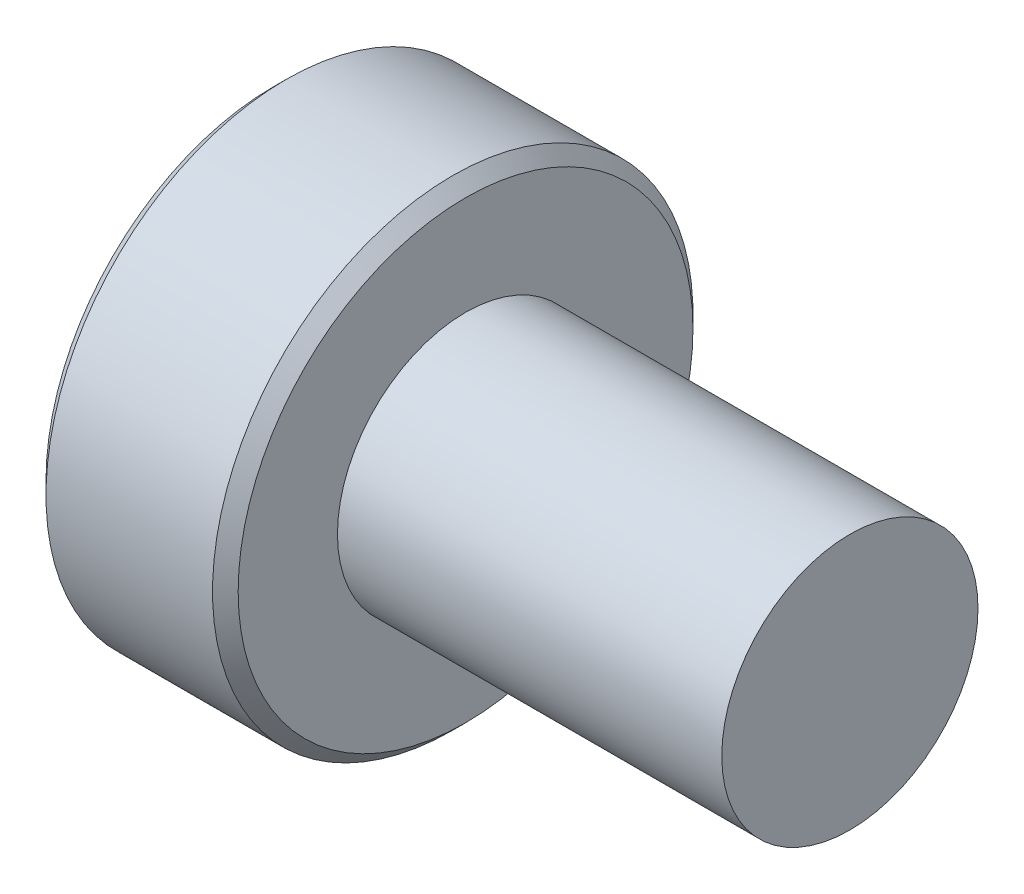
from build123d import *

# Parameters (mm, degrees)
CHAMFER1_SIZE = 0.2


with BuildPart() as part:
    # Sketch1 → Revolve1 (revolve)
    with BuildSketch(Plane.XY, mode=Mode.PRIVATE) as revolve1_sk:
        Polygon((0, 0), (0, 3.75), (3, 3.75), (3, 2), (9, 2), (9, 0), align=None)
    revolve(revolve1_sk.sketch.rotate(Axis((9, 0, 0), (-1, 0, 0)), 180), axis=Axis((9, 0, 0), (-1, 0, 0)))

    # Chamfer1
    chamfer1_edges = [part.edges().sort_by_distance(p)[0] for p in [
        (3, 3.75, 0),
        (0, 3.75, 0),
    ]]
    chamfer(chamfer1_edges, length=CHAMFER1_SIZE)


solid = part.part
